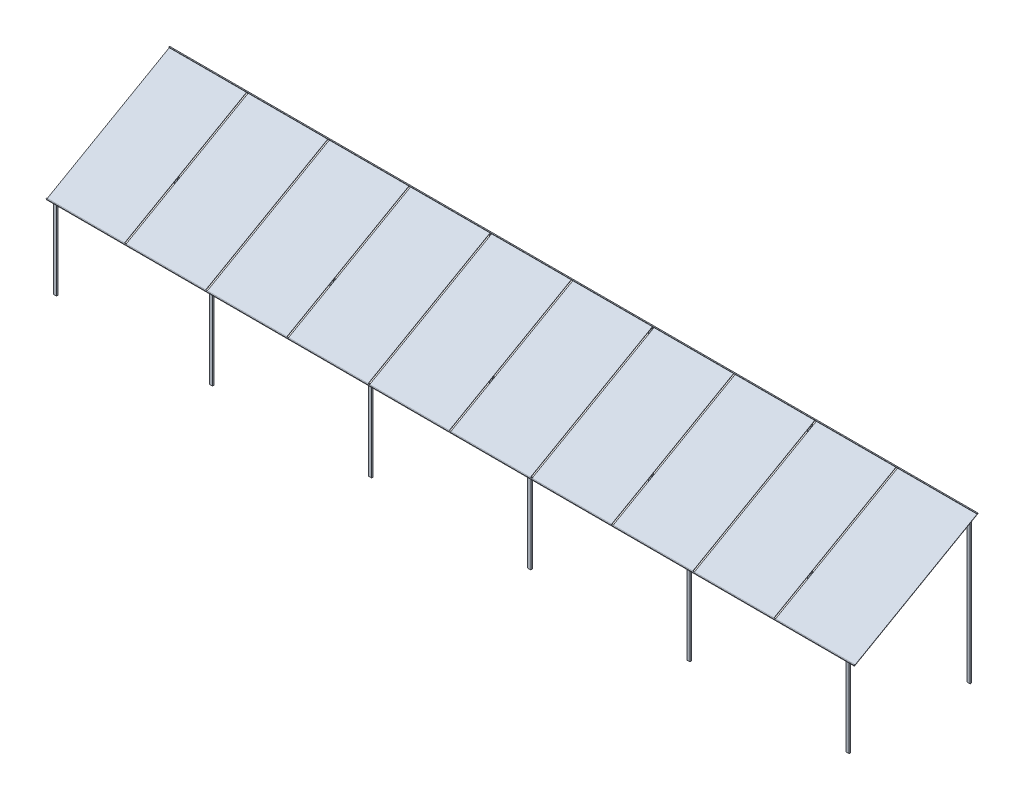
from build123d import *

# Parameters (mm, degrees)
SKETCH1_W              = 40
SKETCH1_H              = 20
SKETCH1_W_2            = 30
SKETCH1_H_2            = 10
BOSS_EXTRUDE1_DEPTH    = 1000
BOSS_EXTRUDE1_2_DEPTH  = 1000
BOSS_EXTRUDE1_3_DEPTH  = 1000
BOSS_EXTRUDE1_4_DEPTH  = 1000
BOSS_EXTRUDE1_5_DEPTH  = 1000
BOSS_EXTRUDE1_6_DEPTH  = 1000
BOSS_EXTRUDE1_7_DEPTH  = 1000
BOSS_EXTRUDE1_8_DEPTH  = 1000
BOSS_EXTRUDE1_9_DEPTH  = 1000
BOSS_EXTRUDE1_10_DEPTH = 1000
BOSS_EXTRUDE1_11_DEPTH = 1000
BOSS_EXTRUDE1_12_DEPTH = 1000
SKETCH1_2_W            = 40
SKETCH1_2_H            = 20
SKETCH1_2_W_2          = 30
SKETCH1_2_H_2          = 10
BOSS_EXTRUDE2_DEPTH    = 1866.025404
BOSS_EXTRUDE3_DEPTH    = 5075.5
SKETCH5_W              = 10
SKETCH5_H              = 1766.777284662
CUT_EXTRUDE1_DEPTH     = 10
SKETCH7_W              = 10151
SKETCH7_H              = 10
BOSS_EXTRUDE4_DEPTH    = 10


with BuildPart() as part:
    # Sketch1 → Boss-Extrude1 (new body)
    with BuildSketch(Plane(origin=(0, 0, 0), x_dir=(1, 0, 0), z_dir=(0, 1, 0))):
        with Locations((4980, 760)):
            Rectangle(SKETCH1_W, SKETCH1_H)
        with Locations((4980, 760)):
            Rectangle(SKETCH1_W_2, SKETCH1_H_2, mode=Mode.SUBTRACT)
    extrude(amount=BOSS_EXTRUDE1_DEPTH)



with BuildPart() as body_2:
    # Sketch1 → Boss-Extrude1 2 (new body)
    with BuildSketch(Plane(origin=(0, 0, 0), x_dir=(1, 0, 0), z_dir=(0, 1, 0))):
        with Locations((4980, -760)):
            Rectangle(SKETCH1_W, SKETCH1_H)
        with Locations((4980, -760)):
            Rectangle(SKETCH1_W_2, SKETCH1_H_2, mode=Mode.SUBTRACT)
    extrude(amount=BOSS_EXTRUDE1_2_DEPTH)


with BuildPart() as body_3:
    # Sketch1 → Boss-Extrude1 3 (new body)
    with BuildSketch(Plane(origin=(0, 0, 0), x_dir=(1, 0, 0), z_dir=(0, 1, 0))):
        with Locations((-4980, -760)):
            Rectangle(SKETCH1_W, SKETCH1_H)
        with Locations((-4980, -760)):
            Rectangle(SKETCH1_W_2, SKETCH1_H_2, mode=Mode.SUBTRACT)
    extrude(amount=BOSS_EXTRUDE1_3_DEPTH)


with BuildPart() as body_4:
    # Sketch1 → Boss-Extrude1 4 (new body)
    with BuildSketch(Plane(origin=(0, 0, 0), x_dir=(1, 0, 0), z_dir=(0, 1, 0))):
        with Locations((-4980, 760)):
            Rectangle(SKETCH1_W, SKETCH1_H)
        with Locations((-4980, 760)):
            Rectangle(SKETCH1_W_2, SKETCH1_H_2, mode=Mode.SUBTRACT)
    extrude(amount=BOSS_EXTRUDE1_4_DEPTH)


with BuildPart() as body_5:
    # Sketch1 → Boss-Extrude1 5 (new body)
    with BuildSketch(Plane(origin=(0, 0, 0), x_dir=(1, 0, 0), z_dir=(0, 1, 0))):
        with Locations((2980, 760)):
            Rectangle(SKETCH1_W, SKETCH1_H)
        with Locations((2980, 760)):
            Rectangle(SKETCH1_W_2, SKETCH1_H_2, mode=Mode.SUBTRACT)
    extrude(amount=BOSS_EXTRUDE1_5_DEPTH)


with BuildPart() as body_6:
    # Sketch1 → Boss-Extrude1 6 (new body)
    with BuildSketch(Plane(origin=(0, 0, 0), x_dir=(1, 0, 0), z_dir=(0, 1, 0))):
        with Locations((2980, -760)):
            Rectangle(SKETCH1_W, SKETCH1_H)
        with Locations((2980, -760)):
            Rectangle(SKETCH1_W_2, SKETCH1_H_2, mode=Mode.SUBTRACT)
    extrude(amount=BOSS_EXTRUDE1_6_DEPTH)


with BuildPart() as body_7:
    # Sketch1 → Boss-Extrude1 7 (new body)
    with BuildSketch(Plane(origin=(0, 0, 0), x_dir=(1, 0, 0), z_dir=(0, 1, 0))):
        with Locations((980, 760)):
            Rectangle(SKETCH1_W, SKETCH1_H)
        with Locations((980, 760)):
            Rectangle(SKETCH1_W_2, SKETCH1_H_2, mode=Mode.SUBTRACT)
    extrude(amount=BOSS_EXTRUDE1_7_DEPTH)


with BuildPart() as body_8:
    # Sketch1 → Boss-Extrude1 8 (new body)
    with BuildSketch(Plane(origin=(0, 0, 0), x_dir=(1, 0, 0), z_dir=(0, 1, 0))):
        with Locations((980, -760)):
            Rectangle(SKETCH1_W, SKETCH1_H)
        with Locations((980, -760)):
            Rectangle(SKETCH1_W_2, SKETCH1_H_2, mode=Mode.SUBTRACT)
    extrude(amount=BOSS_EXTRUDE1_8_DEPTH)


with BuildPart() as body_9:
    # Sketch1 → Boss-Extrude1 9 (new body)
    with BuildSketch(Plane(origin=(0, 0, 0), x_dir=(1, 0, 0), z_dir=(0, 1, 0))):
        with Locations((-1020, 760)):
            Rectangle(SKETCH1_W, SKETCH1_H)
        with Locations((-1020, 760)):
            Rectangle(SKETCH1_W_2, SKETCH1_H_2, mode=Mode.SUBTRACT)
    extrude(amount=BOSS_EXTRUDE1_9_DEPTH)


with BuildPart() as body_10:
    # Sketch1 → Boss-Extrude1 10 (new body)
    with BuildSketch(Plane(origin=(0, 0, 0), x_dir=(1, 0, 0), z_dir=(0, 1, 0))):
        with Locations((-1020, -760)):
            Rectangle(SKETCH1_W, SKETCH1_H)
        with Locations((-1020, -760)):
            Rectangle(SKETCH1_W_2, SKETCH1_H_2, mode=Mode.SUBTRACT)
    extrude(amount=BOSS_EXTRUDE1_10_DEPTH)


with BuildPart() as body_11:
    # Sketch1 → Boss-Extrude1 11 (new body)
    with BuildSketch(Plane(origin=(0, 0, 0), x_dir=(1, 0, 0), z_dir=(0, 1, 0))):
        with Locations((-3020, 760)):
            Rectangle(SKETCH1_W, SKETCH1_H)
        with Locations((-3020, 760)):
            Rectangle(SKETCH1_W_2, SKETCH1_H_2, mode=Mode.SUBTRACT)
    extrude(amount=BOSS_EXTRUDE1_11_DEPTH)


with BuildPart() as body_12:
    # Sketch1 → Boss-Extrude1 12 (new body)
    with BuildSketch(Plane(origin=(0, 0, 0), x_dir=(1, 0, 0), z_dir=(0, 1, 0))):
        with Locations((-3020, -760)):
            Rectangle(SKETCH1_W, SKETCH1_H)
        with Locations((-3020, -760)):
            Rectangle(SKETCH1_W_2, SKETCH1_H_2, mode=Mode.SUBTRACT)
    extrude(amount=BOSS_EXTRUDE1_12_DEPTH)


with BuildPart() as part_1:
    add(part.part)

    add(body_4.part)  # Boss-Extrude2 merges body 4

    add(body_5.part)  # Boss-Extrude2 merges body 5

    add(body_7.part)  # Boss-Extrude2 merges body 7

    add(body_9.part)  # Boss-Extrude2 merges body 9

    add(body_11.part)  # Boss-Extrude2 merges body 11
    # Sketch1<2> → Boss-Extrude2 (add)
    # profile 1 of 6: a face of its own
    with BuildSketch(Plane(origin=(0, 0, 0), x_dir=(1, 0, 0), z_dir=(0, 1, 0))):
        with Locations((-4980, 760)):
            Rectangle(SKETCH1_2_W, SKETCH1_2_H)
        with Locations((-4980, 760)):
            Rectangle(SKETCH1_2_W_2, SKETCH1_2_H_2, mode=Mode.SUBTRACT)
    # profile 2 of 6: a face of its own
    with BuildSketch(Plane(origin=(0, 0, 0), x_dir=(1, 0, 0), z_dir=(0, 1, 0))):
        with Locations((-1020, 760)):
            Rectangle(SKETCH1_2_W, SKETCH1_2_H)
        with Locations((-1020, 760)):
            Rectangle(SKETCH1_2_W_2, SKETCH1_2_H_2, mode=Mode.SUBTRACT)
    # profile 3 of 6: a face of its own
    with BuildSketch(Plane(origin=(0, 0, 0), x_dir=(1, 0, 0), z_dir=(0, 1, 0))):
        with Locations((980, 760)):
            Rectangle(SKETCH1_2_W, SKETCH1_2_H)
        with Locations((980, 760)):
            Rectangle(SKETCH1_2_W_2, SKETCH1_2_H_2, mode=Mode.SUBTRACT)
    # profile 4 of 6: a face of its own
    with BuildSketch(Plane(origin=(0, 0, 0), x_dir=(1, 0, 0), z_dir=(0, 1, 0))):
        with Locations((2980, 760)):
            Rectangle(SKETCH1_2_W, SKETCH1_2_H)
        with Locations((2980, 760)):
            Rectangle(SKETCH1_2_W_2, SKETCH1_2_H_2, mode=Mode.SUBTRACT)
    # profile 5 of 6: a face of its own
    with BuildSketch(Plane(origin=(0, 0, 0), x_dir=(1, 0, 0), z_dir=(0, 1, 0))):
        with Locations((4980, 760)):
            Rectangle(SKETCH1_2_W, SKETCH1_2_H)
    # profile 6 of 6: a face of its own
    with BuildSketch(Plane(origin=(0, 0, 0), x_dir=(1, 0, 0), z_dir=(0, 1, 0))):
        with Locations((-3020, 760)):
            Rectangle(SKETCH1_2_W, SKETCH1_2_H)
    extrude(amount=BOSS_EXTRUDE2_DEPTH)


with BuildPart() as body_8_2:
    # Sketch4 → Boss-Extrude3 (new, symmetric)
    with BuildSketch(Plane(origin=(0, 0, 0), x_dir=(0, 0, -1), z_dir=(1, 0, 0))):
        Polygon((-778.688693777, 995.049585831), (773.787373688, 1879.57834451), (771.312166604, 1883.922691399), (-781.163900862, 999.39393272), align=None)
    extrude(amount=BOSS_EXTRUDE3_DEPTH, both=True)


with BuildPart() as cut_extrude1_tool:
    # Sketch5 → Cut-Extrude1 (new body)
    with BuildSketch(Plane(origin=(0, 1090.475614889, 621.302358356), x_dir=(1, 0, 0), z_dir=(0, 0.8688693777295536, 0.4950414168974737))):
        with Locations((4070.5, 709.400638377)):
            Rectangle(SKETCH5_W, SKETCH5_H)
        with Locations((4060.5, 709.400638377)):
            Rectangle(SKETCH5_W, SKETCH5_H)
        with Locations((3040.5, 709.400638377)):
            Rectangle(SKETCH5_W, SKETCH5_H)
        with Locations((3050.5, 709.400638377)):
            Rectangle(SKETCH5_W, SKETCH5_H)
        with Locations((2020.5, 709.400638377)):
            Rectangle(SKETCH5_W, SKETCH5_H)
        with Locations((2030.5, 709.400638377)):
            Rectangle(SKETCH5_W, SKETCH5_H)
        with Locations((1000.5, 709.400638377)):
            Rectangle(SKETCH5_W, SKETCH5_H)
        with Locations((1010.5, 709.400638377)):
            Rectangle(SKETCH5_W, SKETCH5_H)
        with Locations((-19.5, 709.400638377)):
            Rectangle(SKETCH5_W, SKETCH5_H)
        with Locations((-9.5, 709.400638377)):
            Rectangle(SKETCH5_W, SKETCH5_H)
        with Locations((-1039.5, 709.400638377)):
            Rectangle(SKETCH5_W, SKETCH5_H)
        with Locations((-1029.5, 709.400638377)):
            Rectangle(SKETCH5_W, SKETCH5_H)
        with Locations((-2059.5, 709.400638377)):
            Rectangle(SKETCH5_W, SKETCH5_H)
        with Locations((-2049.5, 709.400638377)):
            Rectangle(SKETCH5_W, SKETCH5_H)
        with Locations((-3079.5, 709.400638377)):
            Rectangle(SKETCH5_W, SKETCH5_H)
        with Locations((-3069.5, 709.400638377)):
            Rectangle(SKETCH5_W, SKETCH5_H)
        with Locations((-4099.5, 709.400638377)):
            Rectangle(SKETCH5_W, SKETCH5_H)
        with Locations((-4089.5, 709.400638377)):
            Rectangle(SKETCH5_W, SKETCH5_H)
        with Locations((-5119.5, 709.400638377)):
            Rectangle(SKETCH5_W, SKETCH5_H)
        with Locations((-5109.5, 709.400638377)):
            Rectangle(SKETCH5_W, SKETCH5_H)
    extrude(amount=-CUT_EXTRUDE1_DEPTH)


with BuildPart() as part_2:
    add(part_1.part)

    # Cut-Extrude1: cut by cut_extrude1_tool
    add(cut_extrude1_tool.part, mode=Mode.SUBTRACT)


with BuildPart() as body_8_1:
    add(body_8.part)

    # Cut-Extrude1: cut by cut_extrude1_tool
    add(cut_extrude1_tool.part, mode=Mode.SUBTRACT)


with BuildPart() as body_10_1:
    add(body_10.part)

    # Cut-Extrude1: cut by cut_extrude1_tool
    add(cut_extrude1_tool.part, mode=Mode.SUBTRACT)


with BuildPart() as body_8_2_1:
    add(body_8_2.part)

    # Cut-Extrude1: cut by cut_extrude1_tool
    add(cut_extrude1_tool.part, mode=Mode.SUBTRACT)

    # Sketch7 → Boss-Extrude4 (add)
    with BuildSketch(Plane(origin=(0, 1090.475614889, 621.302358356), x_dir=(1, 0, 0), z_dir=(0, 0.8688693777295536, 0.4950414168974737))):
        with Locations((0, 1597.789280708)):
            Rectangle(SKETCH7_W, SKETCH7_H)
        with Locations((0, -178.988003954)):
            Rectangle(SKETCH7_W, SKETCH7_H)
    extrude(amount=BOSS_EXTRUDE4_DEPTH)


solid = Compound([body_2.part, body_3.part, body_6.part, body_12.part, part_2.part, body_8_1.part, body_10_1.part, body_8_2_1.part])
